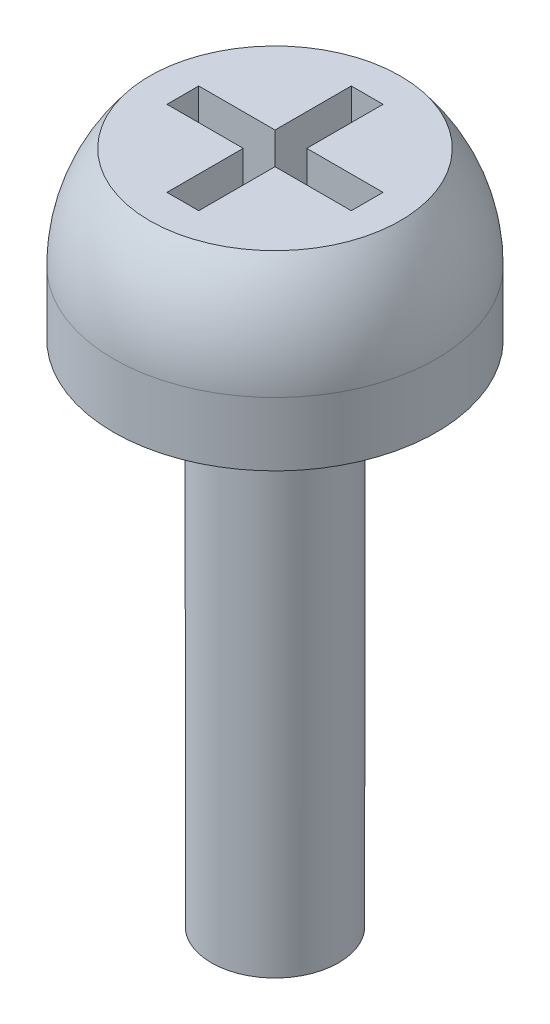
from build123d import *

# Parameters (mm, degrees)
SKETCH1_R           = 1.27
BOSS_EXTRUDE1_DEPTH = 0.5
REVOLVE1_ANGLE      = 180
SKETCH3_R           = 2.5
CUT_EXTRUDE2_DEPTH  = 1.016
CUT_EXTRUDE3_DEPTH  = 1.016
SKETCH6_R           = 0.5
BOSS_EXTRUDE2_DEPTH = 4


with BuildPart() as part:
    # Sketch1 → Boss-Extrude1 (new body)
    with BuildSketch(Plane(origin=(0, 0, 0), x_dir=(1, 0, 0), z_dir=(0, 1, 0))):
        with Locations(Location((0, 0, 0), (0, 0, 270))):
            Circle(SKETCH1_R)
    extrude(amount=BOSS_EXTRUDE1_DEPTH)

    # Sketch2 → Revolve1 (revolve)
    with BuildSketch(Plane(origin=(0, 0.5, 0), x_dir=(1, 0, 0), z_dir=(0, 1, 0))):
        with BuildLine():
            Line((0, 1.27), (0, -1.27))
            ThreePointArc((0, -1.27), (-1.27, 0), (0, 1.27))
        make_face()
    revolve(axis=Axis((0, 0.5, -1.27), (0, 0, -1)), revolution_arc=REVOLVE1_ANGLE)

    # Sketch3 → Cut-Extrude2 (cut)
    with BuildSketch(Plane(origin=(0, 1.3, 0), x_dir=(-1, 0, 0), z_dir=(0, -1, 0))):
        Circle(SKETCH3_R)
    extrude(amount=-CUT_EXTRUDE2_DEPTH, mode=Mode.SUBTRACT)

    # Sketch5 → Cut-Extrude3 (cut)
    with BuildSketch(Plane(origin=(0, 1.3, 0), x_dir=(-1, 0, 0), z_dir=(0, -1, 0))):
        Polygon((0.125, 0.725), (0.125, 0.125), (0.725, 0.125), (0.725, -0.125), (0.125, -0.125), (0.125, -0.725), (-0.125, -0.725), (-0.125, -0.125), (-0.725, -0.125), (-0.725, 0.125), (-0.125, 0.125), (-0.125, 0.725), align=None)
    extrude(amount=CUT_EXTRUDE3_DEPTH, mode=Mode.SUBTRACT)

    # Sketch6 → Boss-Extrude2 (add)
    with BuildSketch(Plane(origin=(0, 0, 0), x_dir=(-1, 0, 0), z_dir=(0, -1, 0))):
        with Locations(Location((0, 0, 0), (0, 0, 270))):
            Circle(SKETCH6_R)
    extrude(amount=BOSS_EXTRUDE2_DEPTH)


solid = part.part
